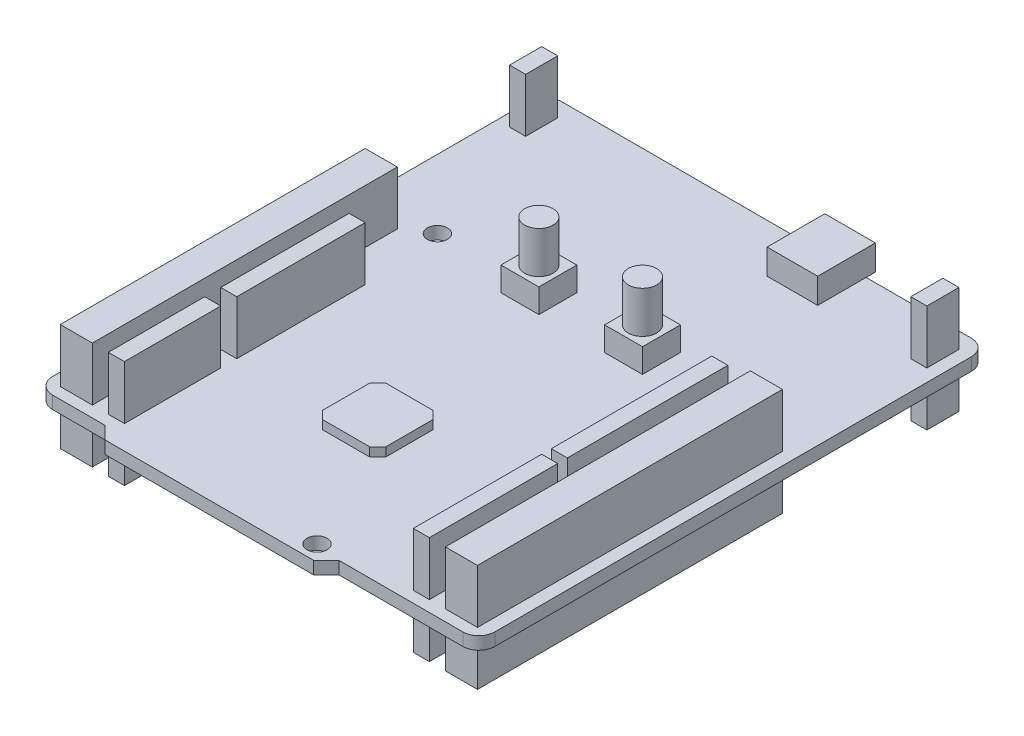
from build123d import *

# Parameters (mm, degrees)
SKETCH1_W           = 70
SKETCH1_H           = 82.5
BOSS_EXTRUDE1_DEPTH = 2
SKETCH2_R           = 1.5875
CUT_EXTRUDE1_DEPTH  = 55.134670037
FILLET1_R           = 2.54
SKETCH2_3_W         = 5.08
SKETCH2_3_H         = 48.26
SKETCH2_3_W_2       = 2.54
SKETCH2_3_H_2       = 25.4
SKETCH2_3_H_3       = 20.32
SKETCH2_3_H_4       = 15.24
SKETCH2_3_H_5       = 5.08
BOSS_EXTRUDE2_DEPTH = 8.500000018
SKETCH4_W           = 8
SKETCH4_H           = 9.13
BOSS_EXTRUDE3_DEPTH = 4
SKETCH4_3_W         = 6
SKETCH4_3_H         = 6
BOSS_EXTRUDE4_DEPTH = 3.8
SKETCH5_R           = 2.25
BOSS_EXTRUDE5_DEPTH = 6.6
SKETCH6_W           = 10
SKETCH6_H           = 10
BOSS_EXTRUDE6_DEPTH = 1.4
CHAMFER1_SIZE       = 1.27


with BuildPart() as part:
    # Sketch1 → Boss-Extrude1 (new body)
    with BuildSketch(Plane(origin=(0, 0, 0), x_dir=(1, 0, 0), z_dir=(0, 1, 0))):
        Rectangle(SKETCH1_W, SKETCH1_H)
    extrude(amount=BOSS_EXTRUDE1_DEPTH)

    # Sketch2 → Cut-Extrude1 (cut, through all)
    with BuildSketch(Plane(origin=(0, 2, 0), x_dir=(1, 0, 0), z_dir=(0, 1, 0))):
        with Locations((8.89, -38.75)):
            Circle(SKETCH2_R)
        with Locations((24.13, 12.05)):
            Circle(SKETCH2_R)
        with Locations((-24.13, 13.32)):
            Circle(SKETCH2_R)
        Polygon((-35, -41.25), (-35, -39.25), (-24.13, -39.25), (-22.13, -41.25), align=None)
        Polygon((35, -39.25), (12.87, -39.25), (10.87, -41.25), (35, -41.25), align=None)
    extrude(amount=-CUT_EXTRUDE1_DEPTH, mode=Mode.SUBTRACT)

    # Fillet1
    fillet1_edges = [part.edges().sort_by_distance(p)[0] for p in [
        (-35, 1, -41.25),
        (35, 1, -41.25),
        (35, 1, 39.25),
        (-35, 1, 39.25),
    ]]
    fillet(fillet1_edges, radius=FILLET1_R)

    # Sketch2<3> → Boss-Extrude2 (add, symmetric)
    with BuildSketch(Plane(origin=(0, 2, 0), x_dir=(1, 0, 0), z_dir=(0, 1, 0))):
        with Locations((30.48, -13.35)):
            Rectangle(SKETCH2_3_W, SKETCH2_3_H)
        with Locations((-30.48, -13.35)):
            Rectangle(SKETCH2_3_W, SKETCH2_3_H)
        with Locations((24.13, -2.94)):
            Rectangle(SKETCH2_3_W_2, SKETCH2_3_H_2)
        with Locations((24.13, -27.32)):
            Rectangle(SKETCH2_3_W_2, SKETCH2_3_H_3)
        with Locations((-24.13, -9.54)):
            Rectangle(SKETCH2_3_W_2, SKETCH2_3_H_3)
        with Locations((-24.13, -29.86)):
            Rectangle(SKETCH2_3_W_2, SKETCH2_3_H_4)
        with Locations((-31.75, 36.18)):
            Rectangle(SKETCH2_3_W_2, SKETCH2_3_H_5)
        with Locations((31.75, 36.18)):
            Rectangle(SKETCH2_3_W_2, SKETCH2_3_H_5)
    extrude(amount=BOSS_EXTRUDE2_DEPTH, both=True)

    # Sketch4 → Boss-Extrude3 (add)
    with BuildSketch(Plane(origin=(0, 2, 0), x_dir=(1, 0, 0), z_dir=(0, 1, 0))):
        with Locations((11.8, 38.145)):
            Rectangle(SKETCH4_W, SKETCH4_H)
    extrude(amount=BOSS_EXTRUDE3_DEPTH)

    # Sketch4<3> → Boss-Extrude4 (add)
    with BuildSketch(Plane(origin=(0, 2, 0), x_dir=(1, 0, 0), z_dir=(0, 1, 0))):
        with Locations((-8, 13.25)):
            Rectangle(SKETCH4_3_W, SKETCH4_3_H)
        with Locations((8.4, 13.25)):
            Rectangle(SKETCH4_3_W, SKETCH4_3_H)
    extrude(amount=BOSS_EXTRUDE4_DEPTH)

    # Sketch5 → Boss-Extrude5 (add)
    with BuildSketch(Plane(origin=(0, 5.8, 0), x_dir=(1, 0, 0), z_dir=(0, 1, 0))):
        with Locations((-8, 13.25)):
            Circle(SKETCH5_R)
        with Locations((8.4, 13.25)):
            Circle(SKETCH5_R)
    extrude(amount=BOSS_EXTRUDE5_DEPTH)

    # Sketch6 → Boss-Extrude6 (add)
    with BuildSketch(Plane(origin=(0, 2, 0), x_dir=(1, 0, 0), z_dir=(0, 1, 0))):
        with Locations((-2.6, -17.65)):
            Rectangle(SKETCH6_W, SKETCH6_H)
    extrude(amount=BOSS_EXTRUDE6_DEPTH)

    # Chamfer1
    chamfer1_edges = [part.edges().sort_by_distance(p)[0] for p in [
        (2.4, 2.7, 22.65),
        (2.4, 2.7, 12.65),
        (-7.6, 2.7, 12.65),
        (-7.6, 2.7, 22.65),
    ]]
    chamfer(chamfer1_edges, length=CHAMFER1_SIZE)


solid = part.part
